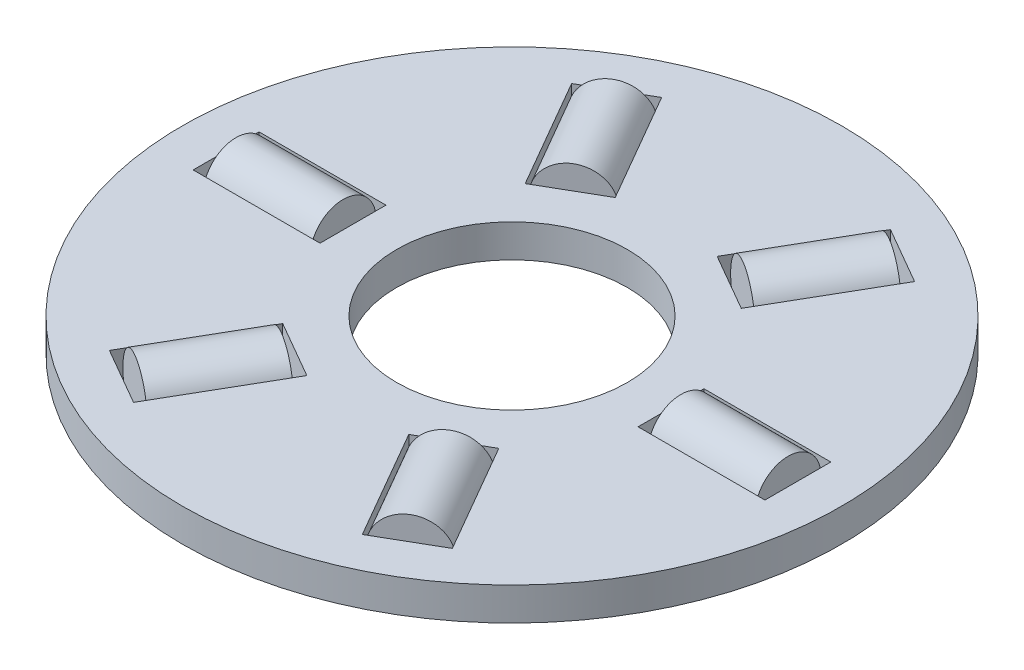
from build123d import *

# Parameters (mm, degrees)
SKETCH_2_W               = 6.5
SKETCH_2_H               = 1
SKETCH_3_W               = 3.85
SKETCH_3_H               = 2
CUT_EXTRUDE_2_DEPTH      = 1
PATTERN_CIRCULAR_1_COUNT = 6
SKETCH_2_6_W             = 3.25
SKETCH_2_6_H             = 1
PATTERN_CIRCULAR_2_COUNT = 6


with BuildPart() as part:
    # 草图2 → 旋转1 (revolve)
    with BuildSketch(Plane.XY):
        with Locations((-6.75, 0)):
            Rectangle(SKETCH_2_W, SKETCH_2_H)
    revolve(axis=Axis((0, 87.206131479, 0), (0, -1, 0)))

    # 草图3 → 切除-拉伸2 (cut, symmetric)
    with BuildSketch(Plane.XY):
        with Locations((-6.75, 0)):
            Rectangle(SKETCH_3_W, SKETCH_3_H)
    cut_extrude_2 = extrude(amount=CUT_EXTRUDE_2_DEPTH, both=True, mode=Mode.SUBTRACT)

    # 阵列(圆周)1: 切除-拉伸2 ×6 about axis
    pattern_circular_1_axis = Axis((0, 87.206131479, 0), (0, 1, 0))
    for i in range(1, PATTERN_CIRCULAR_1_COUNT):
        add(cut_extrude_2.rotate(pattern_circular_1_axis, i * 360 / PATTERN_CIRCULAR_1_COUNT), mode=Mode.SUBTRACT)


with BuildPart() as body_2:
    # 草图2<6> → 旋转5 (revolve)
    with BuildSketch(Plane.XY):
        with Locations((-6.75, 0.5)):
            Rectangle(SKETCH_2_6_W, SKETCH_2_6_H)
    revolve(axis=Axis((-94.332720146, 0, 0), (1, 0, 0)))


with BuildPart() as pattern_circular_2_1:
    # 阵列(圆周)2: pattern copy
    add(body_2.part.rotate(Axis((0, 87.206131479, 0), (0, 1, 0)), 1 * 360 / PATTERN_CIRCULAR_2_COUNT))


with BuildPart() as pattern_circular_2_2:
    # 阵列(圆周)2: pattern copy
    add(body_2.part.rotate(Axis((0, 87.206131479, 0), (0, 1, 0)), 2 * 360 / PATTERN_CIRCULAR_2_COUNT))


with BuildPart() as pattern_circular_2_3:
    # 阵列(圆周)2: pattern copy
    add(body_2.part.rotate(Axis((0, 87.206131479, 0), (0, 1, 0)), 3 * 360 / PATTERN_CIRCULAR_2_COUNT))


with BuildPart() as pattern_circular_2_4:
    # 阵列(圆周)2: pattern copy
    add(body_2.part.rotate(Axis((0, 87.206131479, 0), (0, 1, 0)), 4 * 360 / PATTERN_CIRCULAR_2_COUNT))


with BuildPart() as pattern_circular_2_5:
    # 阵列(圆周)2: pattern copy
    add(body_2.part.rotate(Axis((0, 87.206131479, 0), (0, 1, 0)), 5 * 360 / PATTERN_CIRCULAR_2_COUNT))


solid = Compound([part.part, body_2.part, pattern_circular_2_1.part, pattern_circular_2_2.part, pattern_circular_2_3.part, pattern_circular_2_4.part, pattern_circular_2_5.part])
